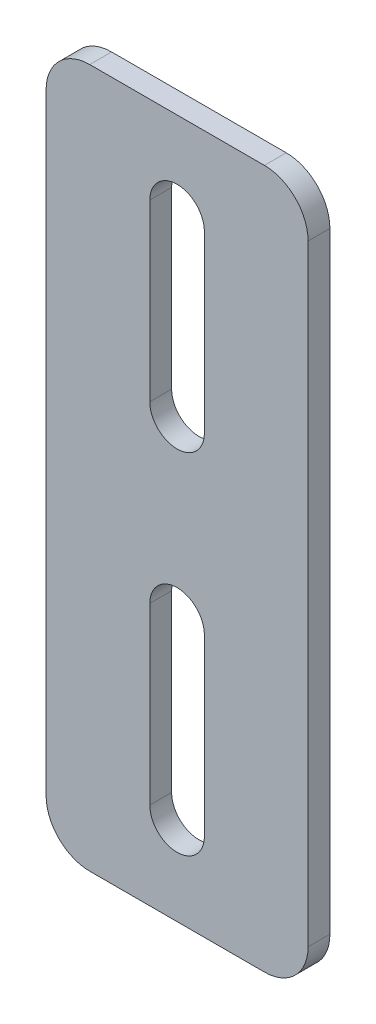
from build123d import *

# Parameters (mm, degrees)
SKETCH1_W           = 38.1
SKETCH1_H           = 101.6
BOSS_EXTRUDE1_DEPTH = 3.175
FILLET1_R           = 6.35
CUT_EXTRUDE1_DEPTH  = 55.34724579


with BuildPart() as part:
    # Sketch1 → Boss-Extrude1 (new body)
    with BuildSketch(Plane.XY):
        Rectangle(SKETCH1_W, SKETCH1_H)
    extrude(amount=BOSS_EXTRUDE1_DEPTH)

    # Fillet1
    fillet1_edges = [part.edges().sort_by_distance(p)[0] for p in [
        (19.05, -50.8, 1.5875),
        (-19.05, -50.8, 1.5875),
        (-19.05, 50.8, 1.5875),
        (19.05, 50.8, 1.5875),
    ]]
    fillet(fillet1_edges, radius=FILLET1_R)

    # Sketch2 → Cut-Extrude1 (cut, through all)
    with BuildSketch(Plane.XY.offset(3.175)):
        with BuildLine():
            Line((3.96875, 38.1), (3.96875, 12.7))
            ThreePointArc((3.96875, 12.7), (0, 8.73125), (-3.96875, 12.7))
            Line((-3.96875, 12.7), (-3.96875, 38.1))
            ThreePointArc((-3.96875, 38.1), (0, 42.06875), (3.96875, 38.1))
        make_face()
        with BuildLine():
            Line((3.96875, -12.7), (3.96875, -38.1))
            ThreePointArc((3.96875, -38.1), (0, -42.06875), (-3.96875, -38.1))
            Line((-3.96875, -38.1), (-3.96875, -12.7))
            ThreePointArc((-3.96875, -12.7), (0, -8.73125), (3.96875, -12.7))
        make_face()
    extrude(amount=-CUT_EXTRUDE1_DEPTH, mode=Mode.SUBTRACT)


solid = part.part
